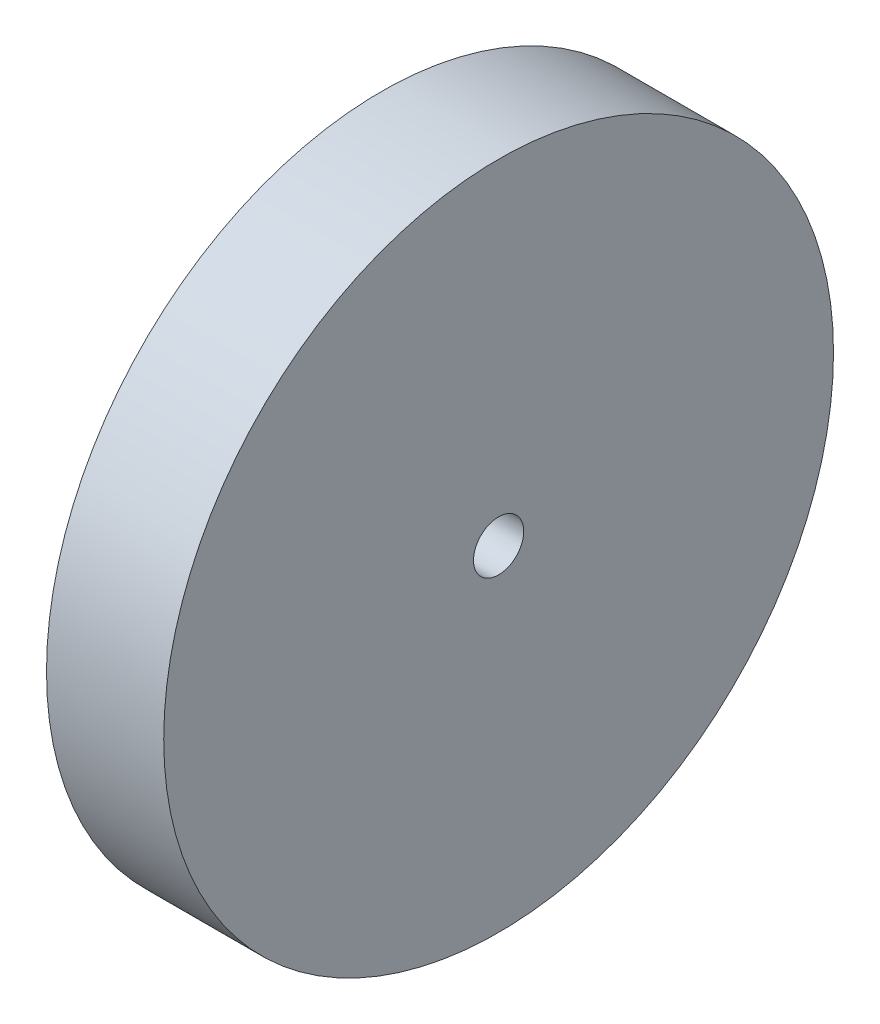
from build123d import *

# Parameters (mm, degrees)
SKETCH1_R           = 20
BOSS_EXTRUDE1_DEPTH = 3.5
SKETCH2_R           = 1.5
CUT_EXTRUDE1_DEPTH  = 7


with BuildPart() as part:
    # Sketch1 → Boss-Extrude1 (new, symmetric)
    with BuildSketch(Plane.YZ):
        with Locations(Location((0, 0, 0), (0, 0, 270))):
            Circle(SKETCH1_R)
    extrude(amount=BOSS_EXTRUDE1_DEPTH, both=True)

    # Sketch2 → Cut-Extrude1 (cut)
    with BuildSketch(Plane.YZ.offset(3.5)):
        with Locations(Location((0, 0, 0), (0, 0, 270))):
            Circle(SKETCH2_R)
    extrude(amount=-CUT_EXTRUDE1_DEPTH, mode=Mode.SUBTRACT)


solid = part.part
